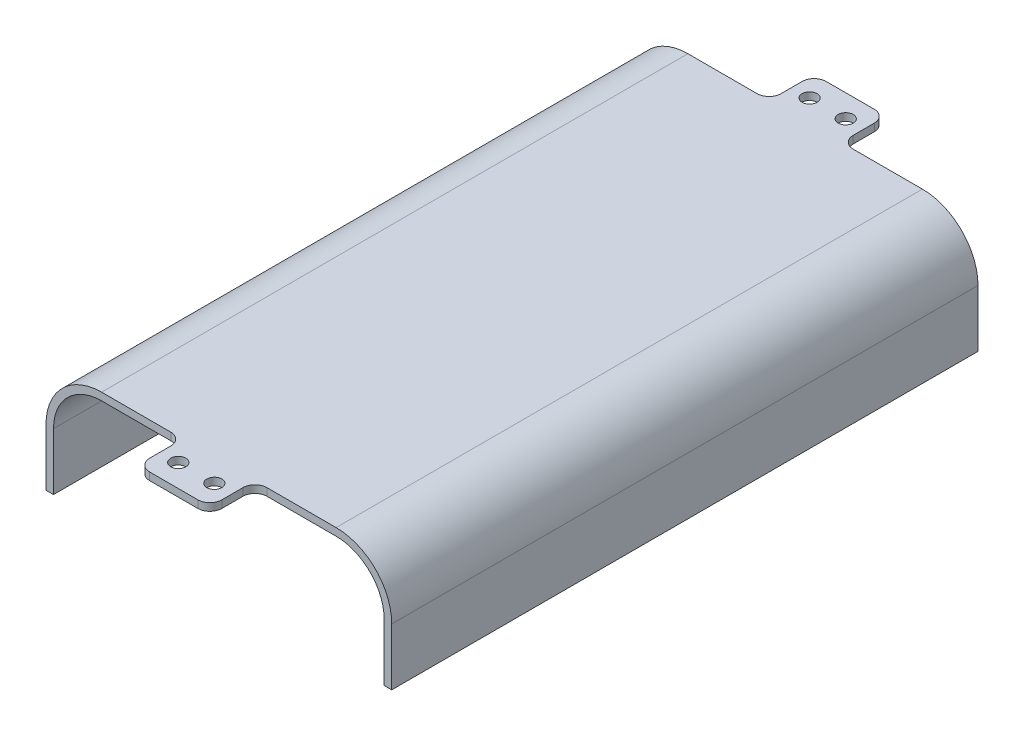
from build123d import *

# Parameters (mm, degrees)
EXTRUDE_1_DEPTH     = 225
SHELL_2_T           = 2.5
SKETCH_2_R          = 2.5
CUT_EXTRUDE_1_DEPTH = 236.239239924


with BuildPart() as part:
    # 草图1 → 凸台-拉伸1 (new body)
    with BuildSketch(Plane.XY):
        with BuildLine():
            Line((-39, 17.5), (39, 17.5))
            ThreePointArc((39, 17.5), (50.313708499, 12.813708499), (55, 1.5))
            Line((55, 1.5), (55, -17.5))
            Line((55, -17.5), (-55, -17.5))
            Line((-55, -17.5), (-55, 1.5))
            ThreePointArc((-55, 1.5), (-50.313708499, 12.813708499), (-39, 17.5))
        make_face()
    extrude(amount=EXTRUDE_1_DEPTH)

    # 抽壳2
    shell_2_openings = [part.faces().sort_by_distance(p)[0] for p in [
        (0, -17.5, 112.5),
        (0, -0.40911681, 0),
        (0, -0.40911681, 225),
    ]]
    offset(amount=SHELL_2_T, openings=shell_2_openings, kind=Kind.INTERSECTION)

    # 草图2 → 切除-拉伸1 (cut, through all)
    with BuildSketch(Plane(origin=(0, 20, 0), x_dir=(1, 0, 0), z_dir=(0, 1, 0))):
        with Locations(Location((-6, -7.5, 0), (0, 0, 270))):
            Circle(SKETCH_2_R)
        with Locations(Location((6, -7.5, 0), (0, 0, 270))):
            Circle(SKETCH_2_R)
        with Locations(Location((6, -217.5, 0), (0, 0, 90))):
            Circle(SKETCH_2_R)
        with Locations(Location((-6, -217.5, 0), (0, 0, 90))):
            Circle(SKETCH_2_R)
        with BuildLine():
            Line((-8, 0), (-68.033168475, 0))
            Line((-68.033168475, 0), (-68.033168475, -15))
            Line((-68.033168475, -15), (-57.5, -15))
            Line((-57.5, -15), (-16, -15))
            ThreePointArc((-16, -15), (-13.171572875, -13.828427125), (-12, -11))
            Line((-12, -11), (-12, -4))
            ThreePointArc((-12, -4), (-10.828427125, -1.171572875), (-8, 0))
        make_face()
        with BuildLine():
            Line((68.316175474, -15), (68.316175474, 0))
            Line((68.316175474, 0), (8, 0))
            ThreePointArc((8, 0), (10.828427125, -1.171572875), (12, -4))
            Line((12, -4), (12, -11))
            ThreePointArc((12, -11), (13.171572875, -13.828427125), (16, -15))
            Line((16, -15), (68.316175474, -15))
        make_face()
        with BuildLine():
            Line((8, -225), (68.316175474, -225))
            Line((68.316175474, -225), (68.316175474, -210))
            Line((68.316175474, -210), (16, -210))
            ThreePointArc((16, -210), (13.171572875, -211.171572875), (12, -214))
            Line((12, -214), (12, -221))
            ThreePointArc((12, -221), (10.828427125, -223.828427125), (8, -225))
        make_face()
        with BuildLine():
            Line((-16, -210), (-57.5, -210))
            Line((-57.5, -210), (-68.033168475, -210))
            Line((-68.033168475, -210), (-68.033168475, -225))
            Line((-68.033168475, -225), (-8, -225))
            ThreePointArc((-8, -225), (-10.828427125, -223.828427125), (-12, -221))
            Line((-12, -221), (-12, -214))
            ThreePointArc((-12, -214), (-13.171572875, -211.171572875), (-16, -210))
        make_face()
    extrude(amount=-CUT_EXTRUDE_1_DEPTH, mode=Mode.SUBTRACT)


solid = part.part
